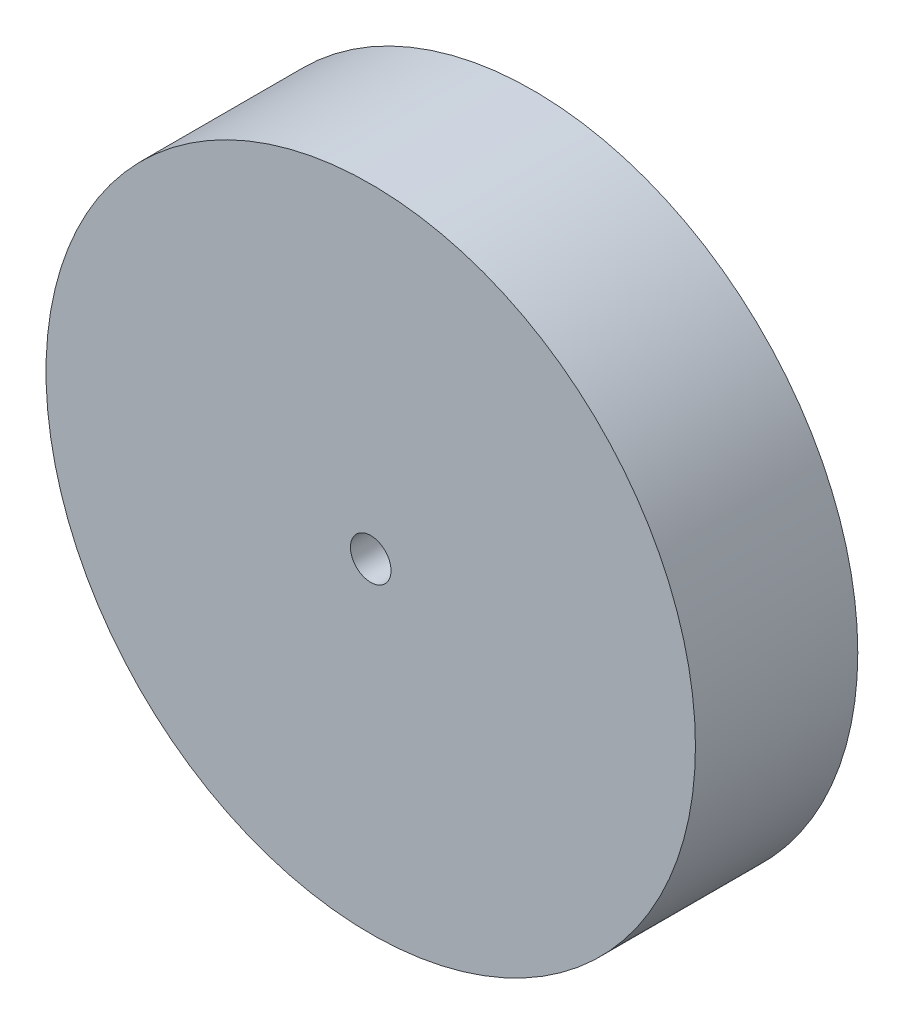
from build123d import *

# Parameters (mm, degrees)
SKETCH1_R           = 101.6
SKETCH1_R_2         = 6.35
BOSS_EXTRUDE1_DEPTH = 50.8


with BuildPart() as part:
    # Sketch1 → Boss-Extrude1 (new body)
    with BuildSketch(Plane.XY):
        Circle(SKETCH1_R)
        Circle(SKETCH1_R_2, mode=Mode.SUBTRACT)
    extrude(amount=BOSS_EXTRUDE1_DEPTH)


solid = part.part
